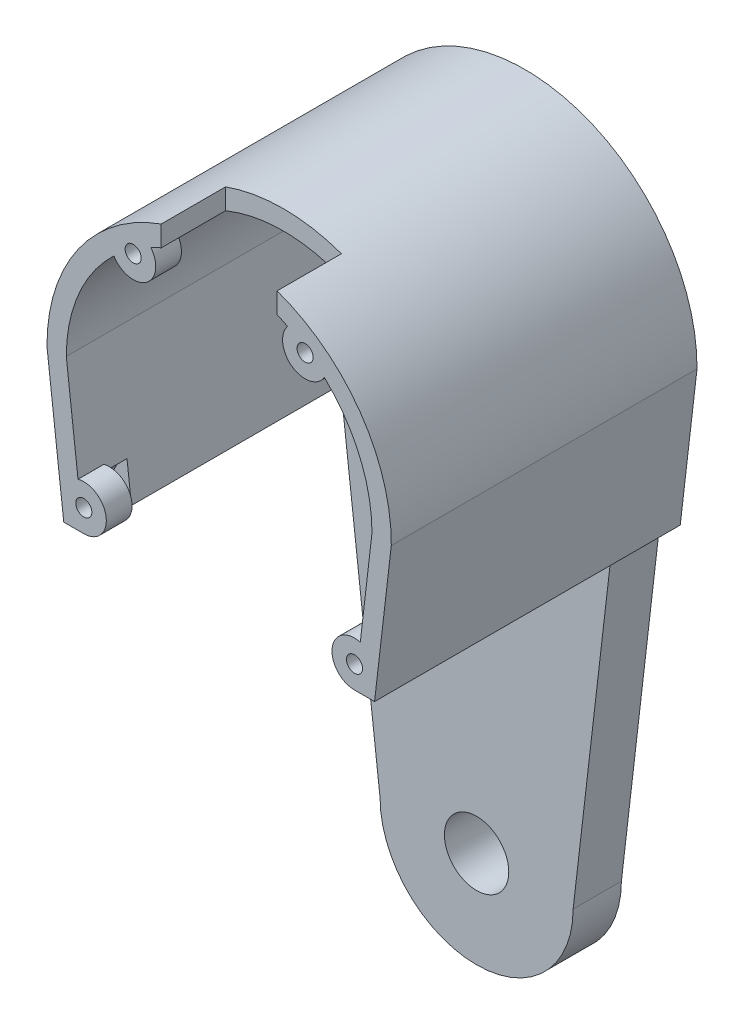
from build123d import *

# Parameters (mm, degrees)
ESQUISSE1_R                    = 1.25
ESQUISSE1_R_2                  = 5
BOSS_EXTRU_1_DEPTH             = 7.5
BOSS_EXTRU_2_DEPTH             = 40
BOSS_EXTRU_2_DIRECTION_2_REACH = 95.383
ESQUISSE4_W                    = 18
ESQUISSE4_H                    = 12.605144054
ENL_V_MAT_EXTRU_1_DEPTH        = 10
ENL_V_START                    = -7.5
ENL_V_MAT_EXTRU_2_DEPTH        = 7.5
BOSS_EXTRU_3_START             = -4
BOSS_EXTRU_3_DEPTH             = 4
BOSS_EXTRU_4_START             = -2
BOSS_EXTRU_4_DEPTH             = 2
ESQUISSE6_R                    = 1.5
ENL_V_MAT_EXTRU_3_DEPTH        = 10
ESQUISSE7_R                    = 3.1
ENL_V_MAT_EXTRU_4_DEPTH        = 2.5
ESQUISSE8_R                    = 3.6
ENL_V_MAT_EXTRU_5_DEPTH        = 0.7


with BuildPart() as part:
    # Esquisse1 → Boss.-Extru.1 (new body)
    with BuildSketch(Plane.XY):
        with BuildLine():
            ThreePointArc((23.75, 0), (0, 23.75), (-23.75, 0))
            Line((-23.75, 0), (-15, -75))
            ThreePointArc((-15, -75), (0, -90), (15, -75))
            Line((15, -75), (23.75, 0))
        make_face()
        with Locations((-5, 5)):
            Circle(ESQUISSE1_R, mode=Mode.SUBTRACT)
        with Locations((5, 5)):
            Circle(ESQUISSE1_R, mode=Mode.SUBTRACT)
        with Locations((5, -5)):
            Circle(ESQUISSE1_R, mode=Mode.SUBTRACT)
        with Locations((-5, -5)):
            Circle(ESQUISSE1_R, mode=Mode.SUBTRACT)
        with Locations((0, -75)):
            Circle(ESQUISSE1_R_2, mode=Mode.SUBTRACT)
    extrude(amount=BOSS_EXTRU_1_DEPTH)

    # Esquisse2 → Boss.-Extru.2 (add)
    with BuildSketch(Plane.XY.offset(7.5)):
        with BuildLine():
            ThreePointArc((-23.75, 0), (0, 23.75), (23.75, 0))
            Line((23.75, 0), (21.125, -22.5))
            Line((21.125, -22.5), (24.145347662, -22.5))
            Line((24.145347662, -22.5), (26.749397242, -0.17957503))
            ThreePointArc((26.749397242, -0.17957503), (0, 26.75), (-26.749397242, -0.17957503))
            Line((-26.749397242, -0.17957503), (-24.145347662, -22.5))
            Line((-24.145347662, -22.5), (-21.125, -22.5))
            Line((-21.125, -22.5), (-23.75, 0))
        make_face()
    extrude(amount=BOSS_EXTRU_2_DEPTH)

    # Boss.-Extru.2 direction 2: up to this face of the body (flat: up to its plane)
    boss_extru_2_direction_2_end = Plane(part.part.faces().sort_by_distance((0, -28.342449308, 0))[0])
    # Esquisse2 → Boss.-Extru.2 direction 2 (add, up to the picked face)
    with BuildSketch(Plane.XY.offset(7.5), mode=Mode.PRIVATE) as boss_extru_2_direction_2_sk1:
        with BuildLine():
            ThreePointArc((-23.75, 0), (0, 23.75), (23.75, 0))
            Line((23.75, 0), (21.125, -22.5))
            Line((21.125, -22.5), (24.145347662, -22.5))
            Line((24.145347662, -22.5), (26.749397242, -0.17957503))
            ThreePointArc((26.749397242, -0.17957503), (0, 26.75), (-26.749397242, -0.17957503))
            Line((-26.749397242, -0.17957503), (-24.145347662, -22.5))
            Line((-24.145347662, -22.5), (-21.125, -22.5))
            Line((-21.125, -22.5), (-23.75, 0))
        make_face()
    boss_extru_2_direction_2_tool1 = split(extrude(boss_extru_2_direction_2_sk1.sketch, amount=-BOSS_EXTRU_2_DIRECTION_2_REACH, mode=Mode.PRIVATE), bisect_by=boss_extru_2_direction_2_end, keep=Keep.BOTH, mode=Mode.PRIVATE)
    add(boss_extru_2_direction_2_tool1.solids().sort_by(Axis((0, 24.477173, 7.5), (0, 0, -1)))[0])

    # Esquisse4 → Enlèv. mat.-Extru.1 (cut)
    with BuildSketch(Plane.XY.offset(47.5)):
        with Locations((0, 26.75)):
            Rectangle(ESQUISSE4_W, ESQUISSE4_H)
    extrude(amount=-ENL_V_MAT_EXTRU_1_DEPTH, mode=Mode.SUBTRACT)

    # Esquisse5 → Enlèv. mat.-Extru.2 (cut)
    with BuildSketch(Plane.XY.offset(47.5).offset(ENL_V_START)):
        with BuildLine():
            Line((-11.411137634, 20.829028732), (-11.640060124, 21.354079473))
            Line((-11.640060124, 21.354079473), (-14.50858003, 21.678003669))
            Line((-14.50858003, 21.678003669), (-16.223366565, 19.355754657))
            Line((-16.223366565, 19.355754657), (-15.594359578, 17.913080398))
            ThreePointArc((-15.594359578, 17.913080398), (-13.581233692, 19.483649335), (-11.411137634, 20.829028732))
        make_face()
        Polygon((-21.820839715, -16.535659582), (-22.588746921, -16.571688322), (-23.913370218, -19.136587239), (-22.354414246, -21.566194123), (-21.240043834, -21.513909991), align=None)
    enl_v_mat_extru_2 = extrude(amount=ENL_V_MAT_EXTRU_2_DEPTH, mode=Mode.SUBTRACT)

    # Esquisse5<3> → Boss.-Extru.3 (add)
    with BuildSketch(Plane.XY.offset(47.5).offset(BOSS_EXTRU_3_START)):
        with BuildLine():
            ThreePointArc((-10.635661114, 21.235470625), (-11.025272446, 21.035823433), (-11.411137634, 20.829028732))
            Line((-11.411137634, 20.829028732), (-10.486326754, 18.707906265))
            Line((-10.486326754, 18.707906265), (-12.201113289, 16.385657254))
            Line((-12.201113289, 16.385657254), (-15.069633195, 16.70958145))
            Line((-15.069633195, 16.70958145), (-15.594359578, 17.913080398))
            ThreePointArc((-15.594359578, 17.913080398), (-15.976876587, 17.572760584), (-16.351968659, 17.224274178))
            ThreePointArc((-16.351968659, 17.224274178), (-12.416744053, 15.659892813), (-9.854846659, 19.031830461))
            ThreePointArc((-9.854846659, 19.031830461), (-10.055820333, 20.200772417), (-10.635661114, 21.235470625))
        make_face()
        with BuildLine():
            ThreePointArc((-17.529790949, -19.001295206), (-18.895919972, -16.227021489), (-21.927845037, -15.618471111))
            Line((-21.927845037, -15.618471111), (-21.820839715, -16.535659582))
            Line((-21.820839715, -16.535659582), (-19.705167652, -16.436396289))
            Line((-19.705167652, -16.436396289), (-18.14621168, -18.866003173))
            Line((-18.14621168, -18.866003173), (-19.470834977, -21.43090209))
            Line((-19.470834977, -21.43090209), (-21.240043834, -21.513909991))
            Line((-21.240043834, -21.513909991), (-21.125, -22.5))
            ThreePointArc((-21.125, -22.5), (-18.588810785, -21.509604565), (-17.529790949, -19.001295206))
        make_face()
    boss_extru_3 = extrude(amount=BOSS_EXTRU_3_DEPTH)

    # Esquisse5<4> → Boss.-Extru.4 (add)
    with BuildSketch(Plane.XY.offset(47.5).offset(BOSS_EXTRU_4_START)):
        with BuildLine():
            Line((-11.411137634, 20.829028732), (-11.640060124, 21.354079473))
            Line((-11.640060124, 21.354079473), (-14.50858003, 21.678003669))
            Line((-14.50858003, 21.678003669), (-16.223366565, 19.355754657))
            Line((-16.223366565, 19.355754657), (-15.594359578, 17.913080398))
            ThreePointArc((-15.594359578, 17.913080398), (-15.089714795, 18.340201945), (-14.573376801, 18.753111438))
            ThreePointArc((-14.573376801, 18.753111438), (-14.072849168, 20.055047153), (-12.678292605, 20.082913051))
            ThreePointArc((-12.678292605, 20.082913051), (-12.050491046, 20.465780355), (-11.411137634, 20.829028732))
        make_face()
        with BuildLine():
            Line((-10.486326754, 18.707906265), (-11.411137634, 20.829028732))
            ThreePointArc((-11.411137634, 20.829028732), (-12.050491046, 20.465780355), (-12.678292605, 20.082913051))
            ThreePointArc((-12.678292605, 20.082913051), (-12.257533448, 19.630498747), (-12.104846659, 19.031830461))
            ThreePointArc((-12.104846659, 19.031830461), (-13.214601654, 17.789722842), (-14.573376801, 18.753111438))
            ThreePointArc((-14.573376801, 18.753111438), (-15.089714795, 18.340201945), (-15.594359578, 17.913080398))
            Line((-15.594359578, 17.913080398), (-15.069633195, 16.70958145))
            Line((-15.069633195, 16.70958145), (-12.201113289, 16.385657254))
            Line((-12.201113289, 16.385657254), (-10.486326754, 18.707906265))
        make_face()
        with BuildLine():
            Line((-19.705167652, -16.436396289), (-21.820839715, -16.535659582))
            Line((-21.820839715, -16.535659582), (-21.659180538, -17.921309676))
            ThreePointArc((-21.659180538, -17.921309676), (-20.406989611, -17.917497027), (-19.779790949, -19.001295206))
            ThreePointArc((-19.779790949, -19.001295206), (-20.285594046, -20.005621333), (-21.393664499, -20.197161436))
            Line((-21.393664499, -20.197161436), (-21.240043834, -21.513909991))
            Line((-21.240043834, -21.513909991), (-19.470834977, -21.43090209))
            Line((-19.470834977, -21.43090209), (-18.14621168, -18.866003173))
            Line((-18.14621168, -18.866003173), (-19.705167652, -16.436396289))
        make_face()
        with BuildLine():
            Line((-21.659180538, -17.921309676), (-21.820839715, -16.535659582))
            Line((-21.820839715, -16.535659582), (-22.588746921, -16.571688322))
            Line((-22.588746921, -16.571688322), (-23.913370218, -19.136587239))
            Line((-23.913370218, -19.136587239), (-22.354414246, -21.566194123))
            Line((-22.354414246, -21.566194123), (-21.240043834, -21.513909991))
            Line((-21.240043834, -21.513909991), (-21.393664499, -20.197161436))
            ThreePointArc((-21.393664499, -20.197161436), (-22.271369873, -19.14614608), (-21.659180538, -17.921309676))
        make_face()
    boss_extru_4 = extrude(amount=BOSS_EXTRU_4_DEPTH)

    # Symétrie1: Enlèv. mat.-Extru.2, Boss.-Extru.3, Boss.-Extru.4 across plane
    add(enl_v_mat_extru_2.mirror(Plane(origin=(0, 0, 0), x_dir=(0, 0, 1), z_dir=(1, 0, 0))), mode=Mode.SUBTRACT)
    add(boss_extru_3.mirror(Plane(origin=(0, 0, 0), x_dir=(0, 0, 1), z_dir=(1, 0, 0))))
    add(boss_extru_4.mirror(Plane(origin=(0, 0, 0), x_dir=(0, 0, 1), z_dir=(1, 0, 0))))

    # Esquisse6 → Enlèv. mat.-Extru.3 (cut)
    with BuildSketch(Plane.XY.offset(7.5)):
        Circle(ESQUISSE6_R)
    extrude(amount=-ENL_V_MAT_EXTRU_3_DEPTH, mode=Mode.SUBTRACT)

    # Esquisse7 → Enlèv. mat.-Extru.4 (cut)
    with BuildSketch(Plane.XY.offset(7.5)):
        Circle(ESQUISSE7_R)
    extrude(amount=-ENL_V_MAT_EXTRU_4_DEPTH, mode=Mode.SUBTRACT)

    # Esquisse8 → Enlèv. mat.-Extru.5 (cut)
    with BuildSketch(Plane.XY.offset(7.5)):
        Circle(ESQUISSE8_R)
    extrude(amount=-ENL_V_MAT_EXTRU_5_DEPTH, mode=Mode.SUBTRACT)


solid = part.part
